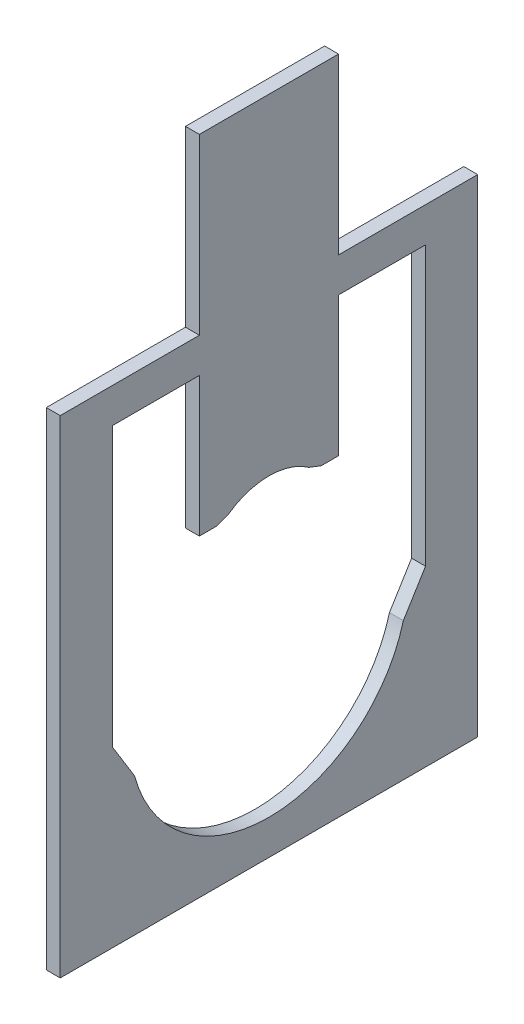
from build123d import *

# Parameters (mm, degrees)
BOSS_EXTRUDE1_DEPTH = 2


with BuildPart() as part:
    # Sketch1 → Boss-Extrude1 (new body)
    with BuildSketch(Plane(origin=(0, 0, 0), x_dir=(0, 0, -1), z_dir=(1, 0, 0))):
        Polygon((20, 0), (0, 0), (0, 25), (-20, 25), (-20, 0), (-40, 0), (-40, -70), (20, -70), align=None)
        with BuildLine():
            ThreePointArc((9.318516526, -50.176380902), (-10, -65), (-29.318516526, -50.176380902))
            Line((-29.318516526, -50.176380902), (-32.5, -45))
            Line((-32.5, -45), (-32.5, -5))
            Line((-32.5, -5), (-20, -5))
            Line((-20, -5), (-20, -25))
            Line((-20, -25), (-17.5, -25))
            Line((-17.5, -25), (-15.75, -24.318465914))
            ThreePointArc((-15.75, -24.318465914), (-10, -22.5), (-4.25, -24.318465914))
            Line((-4.25, -24.318465914), (-2.5, -25))
            Line((-2.5, -25), (0, -25))
            Line((0, -25), (0, -4.981590289))
            Line((0, -4.981590289), (12.5, -5))
            Line((12.5, -5), (12.5, -45))
            Line((12.5, -45), (9.318516526, -50.176380902))
        make_face(mode=Mode.SUBTRACT)
    extrude(amount=BOSS_EXTRUDE1_DEPTH)


solid = part.part
